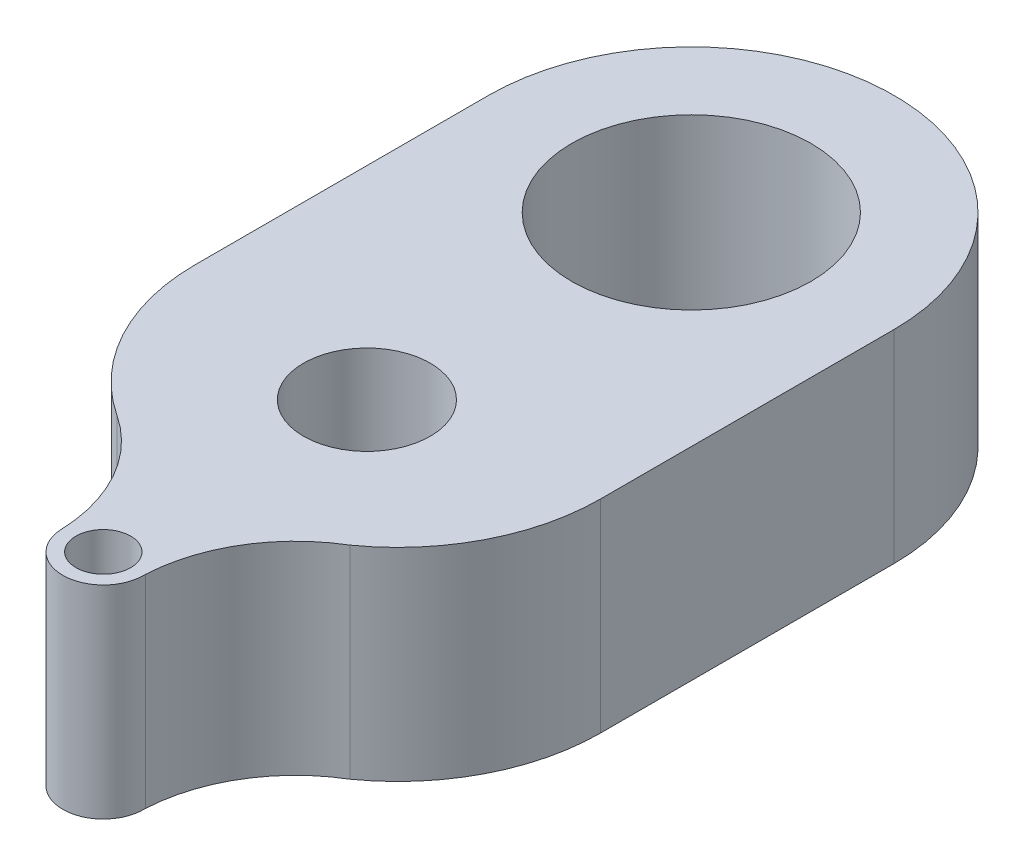
from build123d import *

# Parameters (mm, degrees)
SKETCH1_R           = 0.396875
SKETCH1_R_2         = 0.7493
SKETCH1_R_3         = 0.254
SKETCH1_R_4         = 0.17145
BOSS_EXTRUDE1_DEPTH = 1.27


with BuildPart() as part:
    # Sketch1 → Boss-Extrude1 (new body)
    # profile 1 of 2: a face of its own
    with BuildSketch(Plane(origin=(0, 0, 0), x_dir=(1, 0, 0), z_dir=(0, 1, 0))):
        with BuildLine():
            ThreePointArc((1.27, 0), (0, 1.27), (-1.27, 0))
            Line((-1.27, 0), (-1.27, -1.838491681))
            ThreePointArc((-1.27, -1.838491681), (-1.11822537, -2.440548175), (-0.699177919, -2.898704037))
            ThreePointArc((-0.699177919, -2.898704037), (-0.380237195, -3.241288343), (-0.253841665, -3.691967121))
            ThreePointArc((-0.253841665, -3.691967121), (-0.008967121, -3.429158335), (0.253841665, -3.674032879))
            ThreePointArc((0.253841665, -3.674032879), (0.394562935, -3.213849735), (0.735263158, -2.874005123))
            ThreePointArc((0.735263158, -2.874005123), (1.128424612, -2.421207645), (1.27, -1.838491681))
            Line((1.27, -1.838491681), (1.27, 0))
        make_face()
        with Locations(Location((0, -2.032, 0), (0, 0, 270))):
            Circle(SKETCH1_R, mode=Mode.SUBTRACT)
        with Locations(Location((0, 0, 0), (0, 0, 270))):
            Circle(SKETCH1_R_2, mode=Mode.SUBTRACT)
    # profile 2 of 2: a face of its own
    with BuildSketch(Plane(origin=(0, 0, 0), x_dir=(1, 0, 0), z_dir=(0, 1, 0))):
        with Locations((0, -3.683)):
            Circle(SKETCH1_R_3)
        with Locations(Location((0, -3.683, 0), (0, 0, 270))):
            Circle(SKETCH1_R_4, mode=Mode.SUBTRACT)
    extrude(amount=BOSS_EXTRUDE1_DEPTH)


solid = part.part
